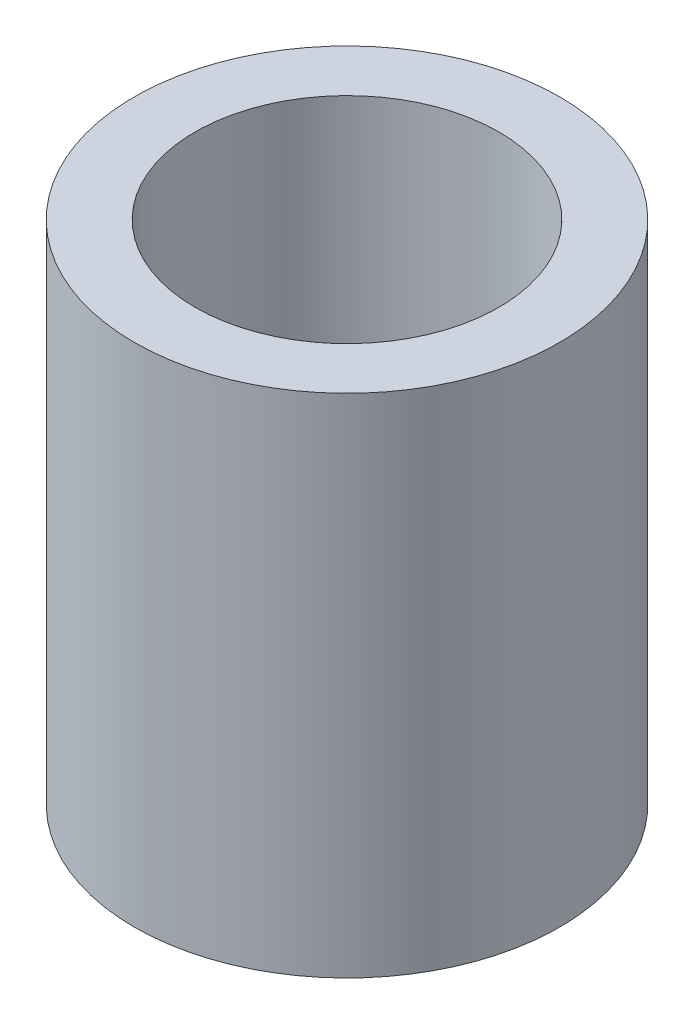
from build123d import *

# Parameters (mm, degrees)
SKETCH_1_R      = 2.1
SKETCH_1_R_2    = 1.5
EXTRUDE_1_DEPTH = 5


with BuildPart() as part:
    # Эскиз1 → Бобышка-Вытянуть1 (new body)
    with BuildSketch(Plane(origin=(0, 0, 0), x_dir=(1, 0, 0), z_dir=(0, 1, 0))):
        with Locations(Location((0, 0, 0), (0, 0, 270))):
            Circle(SKETCH_1_R)
        with Locations(Location((0, 0, 0), (0, 0, 270))):
            Circle(SKETCH_1_R_2, mode=Mode.SUBTRACT)
    extrude(amount=EXTRUDE_1_DEPTH)


solid = part.part
